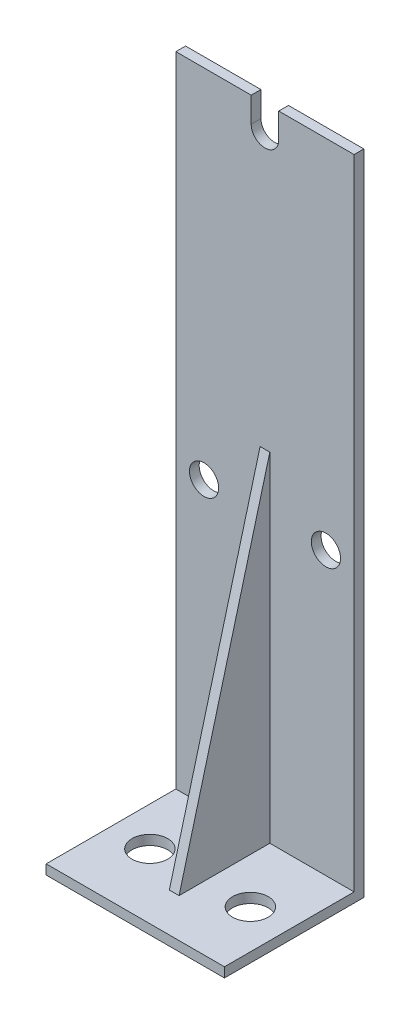
from build123d import *

# Parameters (mm, degrees)
SZKIC1_W                    = 55
SZKIC1_H                    = 200
DODANIE_WYCI_GNI_CIE1_DEPTH = 1.5
SZKIC2_W                    = 55
SZKIC2_H                    = 3
DODANIE_WYCI_GNI_CIE2_DEPTH = 40
SZKIC3_R                    = 5.5
WYTNIJ_WYCI_GNI_CIE1_DEPTH  = 20
DODANIE_WYCI_GNI_CIE3_DEPTH = 1.5
SZKIC5_R                    = 4.5
WYTNIJ_WYCI_GNI_CIE3_DEPTH  = 212.834841327


with BuildPart() as part:
    # Szkic1 → Dodanie-wyciągnięcie1 (new, symmetric)
    with BuildSketch(Plane.XY):
        with Locations((27.5, 100)):
            Rectangle(SZKIC1_W, SZKIC1_H)
    extrude(amount=DODANIE_WYCI_GNI_CIE1_DEPTH, both=True)



with BuildPart() as body_2:
    # Szkic2 → Dodanie-wyciągnięcie2 (new body)
    with BuildSketch(Plane.XY.offset(1.5)):
        with Locations((27.5, 1.5)):
            Rectangle(SZKIC2_W, SZKIC2_H)
    extrude(amount=DODANIE_WYCI_GNI_CIE2_DEPTH)

    # Szkic3 → Wytnij-wyciągnięcie1 (cut)
    with BuildSketch(Plane(origin=(0, 3, 0), x_dir=(1, 0, 0), z_dir=(0, 1, 0))):
        with Locations(Location((12, -21.5, 0), (0, 0, 270))):
            Circle(SZKIC3_R)
        with Locations(Location((43, -21.5, 0), (0, 0, 270))):
            Circle(SZKIC3_R)
    extrude(amount=-WYTNIJ_WYCI_GNI_CIE1_DEPTH, mode=Mode.SUBTRACT)


with BuildPart() as part_1:
    add(part.part)

    add(body_2.part)  # Dodanie-wyciągnięcie3 merges body 2
    # Szkic4 → Dodanie-wyciągnięcie3 (add, symmetric)
    with BuildSketch(Plane(origin=(27.5, 0, 0), x_dir=(0, 0, -1), z_dir=(1, 0, 0))):
        Polygon((-29.5, 3), (-1.5, 107.497422612), (-1.5, 3), align=None)
    extrude(amount=DODANIE_WYCI_GNI_CIE3_DEPTH, both=True)

    # Szkic5 → Wytnij-wyciągnięcie3 (cut, through all)
    with BuildSketch(Plane(origin=(0, 0, -1.5), x_dir=(-1, 0, 0), z_dir=(0, 0, -1))):
        with Locations((-8.7, 90)):
            Circle(SZKIC5_R)
        with Locations((-46.3, 90)):
            Circle(SZKIC5_R)
        with BuildLine():
            Line((-31.75, 200), (-31.75, 192.25))
            ThreePointArc((-31.75, 192.25), (-27.5, 188), (-23.25, 192.25))
            Line((-23.25, 192.25), (-23.25, 200))
            Line((-23.25, 200), (-31.75, 200))
        make_face()
    extrude(amount=-WYTNIJ_WYCI_GNI_CIE3_DEPTH, mode=Mode.SUBTRACT)


solid = part_1.part
